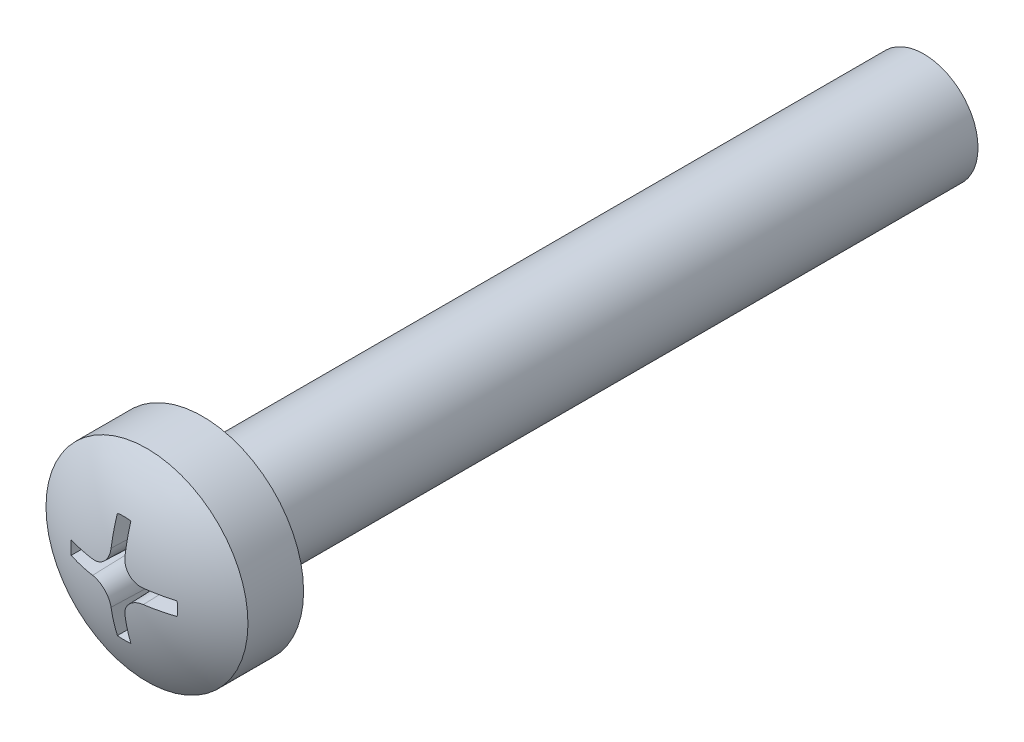
from build123d import *

# Parameters (mm, degrees)
SKETCH1_R          = 1.5
BASE_EXTRUDE_DEPTH = 20
CUT_EXTRUDE1_DEPTH = 1.799999969
CUT_EXTRUDE1_TAPER = 2


with BuildPart() as part:
    # Sketch1 → Base-Extrude (new body)
    with BuildSketch(Plane.XY):
        Circle(SKETCH1_R)
    extrude(amount=BASE_EXTRUDE_DEPTH)

    # Sketch6 → Boss-Revolve2 (revolve)
    with BuildSketch(Plane(origin=(0, 0, 0), x_dir=(1, 0, 0), z_dir=(0, 1, 0)), mode=Mode.PRIVATE) as boss_revolve2_sk:
        with BuildLine():
            Line((0, -20), (2.7999999, -20))
            Line((2.7999999, -20), (2.7999999, -21.54246308))
            ThreePointArc((2.7999999, -21.54246308), (1.46418655, -22.180811406), (0, -22.4))
            Line((0, -22.4), (0, -20))
        make_face()
    revolve(boss_revolve2_sk.sketch.rotate(Axis((0, 0, -0.393620135), (0, 0, 1)), 180), axis=Axis((0, 0, -0.393620135), (0, 0, 1)))

    # Sketch7 → Cut-Extrude1 (cut)
    with BuildSketch(Plane(origin=(0, 0, 22.7000001), x_dir=(-1, 0, 0), z_dir=(0, 0, -1))):
        with BuildLine():
            ThreePointArc((0.205000004, 1.48592565), (0, 1.500000013), (-0.205000004, 1.48592565))
            Line((-0.205000004, 1.48592565), (-0.205000004, 0.708178558))
            ThreePointArc((-0.205000004, 0.708178558), (-0.35072876, 0.355344481), (-0.702967546, 0.208182689))
            Line((-0.702967546, 0.208182689), (-1.48592565, 0.205000004))
            ThreePointArc((-1.48592565, 0.205000004), (-1.500000013, 0), (-1.48592565, -0.205000004))
            Line((-1.48592565, -0.205000004), (-0.702967546, -0.208182689))
            ThreePointArc((-0.702967546, -0.208182689), (-0.35072876, -0.355344481), (-0.205000004, -0.708178558))
            Line((-0.205000004, -0.708178558), (-0.205000004, -1.48592565))
            ThreePointArc((-0.205000004, -1.48592565), (0, -1.500000013), (0.205000004, -1.48592565))
            Line((0.205000004, -1.48592565), (0.205000004, -0.708178558))
            ThreePointArc((0.205000004, -0.708178558), (0.35072876, -0.355344481), (0.702967546, -0.208182689))
            Line((0.702967546, -0.208182689), (1.48592565, -0.205000004))
            ThreePointArc((1.48592565, -0.205000004), (1.500000013, 0), (1.48592565, 0.205000004))
            Line((1.48592565, 0.205000004), (0.702967546, 0.208182689))
            ThreePointArc((0.702967546, 0.208182689), (0.35072876, 0.355344481), (0.205000004, 0.708178558))
            Line((0.205000004, 0.708178558), (0.205000004, 1.48592565))
        make_face()
    extrude(amount=CUT_EXTRUDE1_DEPTH, taper=CUT_EXTRUDE1_TAPER, mode=Mode.SUBTRACT)


solid = part.part
